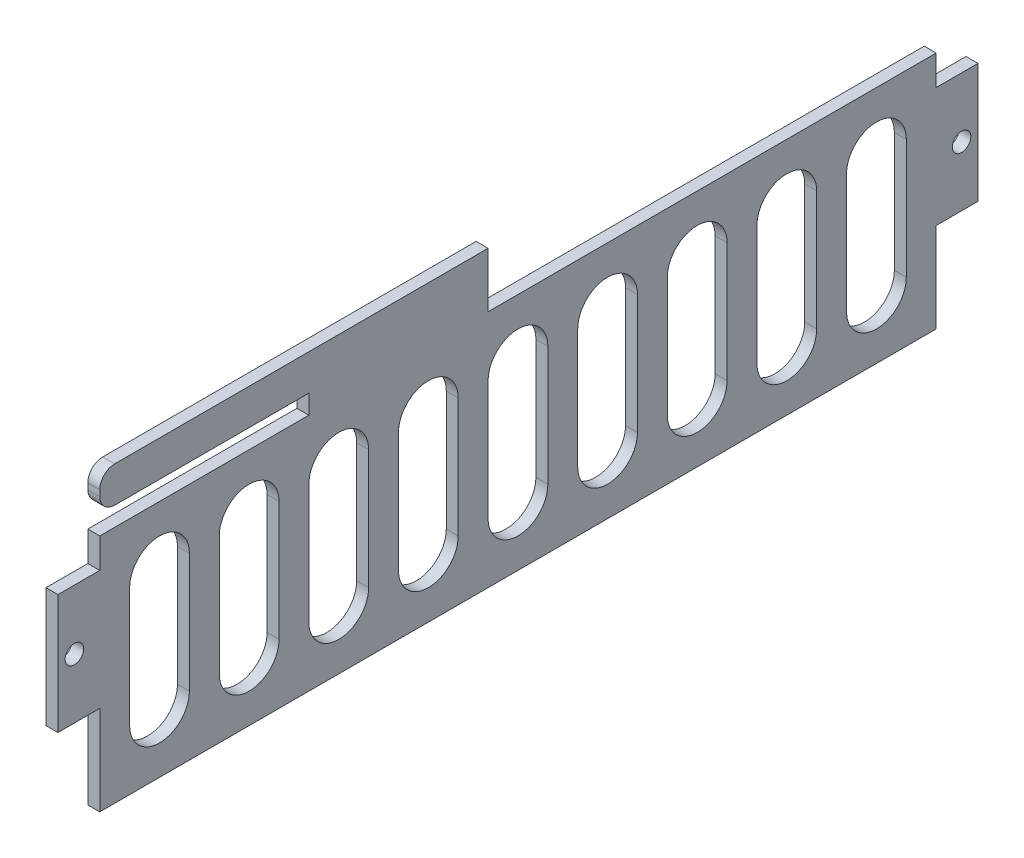
from build123d import *

# Parameters (mm, degrees)
SKETCH_1_W          = 140
SKETCH_1_H          = 40
SKETCH_1_W_2        = 7
SKETCH_1_H_2        = 20
SKETCH_1_W_3        = 30
SKETCH_1_H_3        = 3.2
EXTRUDE_1_DEPTH     = 2
CUT_EXTRUDE_1_DEPTH = 3
SKETCH_3_R          = 1.55
CUT_EXTRUDE_2_DEPTH = 3


with BuildPart() as part:
    # 草图1 → 凸台-拉伸1 (new body)
    with BuildSketch(Plane(origin=(0, 0, 0), x_dir=(0, 0, -1), z_dir=(1, 0, 0))):
        Rectangle(SKETCH_1_W, SKETCH_1_H)
        with Locations((-73.5, 5)):
            Rectangle(SKETCH_1_W_2, SKETCH_1_H_2)
        with BuildLine():
            Line((-67.5, 23.2), (-35, 23.2))
            Line((-35, 23.2), (-5, 23.2))
            Line((-5, 23.2), (-5, 29.2))
            Line((-5, 29.2), (-67.5, 29.2))
            ThreePointArc((-67.5, 29.2), (-69.267766953, 28.467766953), (-70, 26.7))
            Line((-70, 26.7), (-70, 25.7))
            ThreePointArc((-70, 25.7), (-69.267766953, 23.932233047), (-67.5, 23.2))
        make_face()
        with Locations((-20, 21.6)):
            Rectangle(SKETCH_1_W_3, SKETCH_1_H_3)
        with Locations((73.5, 5)):
            Rectangle(SKETCH_1_W_2, SKETCH_1_H_2)
    extrude(amount=EXTRUDE_1_DEPTH)

    # 草图2 → 切除-拉伸1 (cut)
    with BuildSketch(Plane(origin=(2, 0, 0), x_dir=(0, 0, -1), z_dir=(1, 0, 0))):
        with BuildLine():
            Line((-65, -10), (-65, 10))
            ThreePointArc((-65, 10), (-60, 15), (-55, 10))
            Line((-55, 10), (-55, -10))
            ThreePointArc((-55, -10), (-60, -15), (-65, -10))
        make_face()
        with BuildLine():
            Line((-50, -10), (-50, 10))
            ThreePointArc((-50, 10), (-45, 15), (-40, 10))
            Line((-40, 10), (-40, -10))
            ThreePointArc((-40, -10), (-45, -15), (-50, -10))
        make_face()
        with BuildLine():
            Line((-35, -10), (-35, 10))
            ThreePointArc((-35, 10), (-30, 15), (-25, 10))
            Line((-25, 10), (-25, -10))
            ThreePointArc((-25, -10), (-30, -15), (-35, -10))
        make_face()
        with BuildLine():
            Line((-20, -10), (-20, 10))
            ThreePointArc((-20, 10), (-15, 15), (-10, 10))
            Line((-10, 10), (-10, -10))
            ThreePointArc((-10, -10), (-15, -15), (-20, -10))
        make_face()
        with BuildLine():
            Line((-5, -10), (-5, 10))
            ThreePointArc((-5, 10), (0, 15), (5, 10))
            Line((5, 10), (5, -10))
            ThreePointArc((5, -10), (0, -15), (-5, -10))
        make_face()
        with BuildLine():
            Line((10, -10), (10, 10))
            ThreePointArc((10, 10), (15, 15), (20, 10))
            Line((20, 10), (20, -10))
            ThreePointArc((20, -10), (15, -15), (10, -10))
        make_face()
        with BuildLine():
            Line((25, -10), (25, 10))
            ThreePointArc((25, 10), (30, 15), (35, 10))
            Line((35, 10), (35, -10))
            ThreePointArc((35, -10), (30, -15), (25, -10))
        make_face()
        with BuildLine():
            Line((40, -10), (40, 10))
            ThreePointArc((40, 10), (45, 15), (50, 10))
            Line((50, 10), (50, -10))
            ThreePointArc((50, -10), (45, -15), (40, -10))
        make_face()
        with BuildLine():
            Line((55, -10), (55, 10))
            ThreePointArc((55, 10), (60, 15), (65, 10))
            Line((65, 10), (65, -10))
            ThreePointArc((65, -10), (60, -15), (55, -10))
        make_face()
    extrude(amount=-CUT_EXTRUDE_1_DEPTH, mode=Mode.SUBTRACT)

    # 草图3 → 切除-拉伸2 (cut)
    with BuildSketch(Plane(origin=(2, 0, 0), x_dir=(0, 0, -1), z_dir=(1, 0, 0))):
        with Locations((-74.25, 5)):
            Circle(SKETCH_3_R)
        with Locations((74.25, 5)):
            Circle(SKETCH_3_R)
    extrude(amount=-CUT_EXTRUDE_2_DEPTH, mode=Mode.SUBTRACT)


solid = part.part
